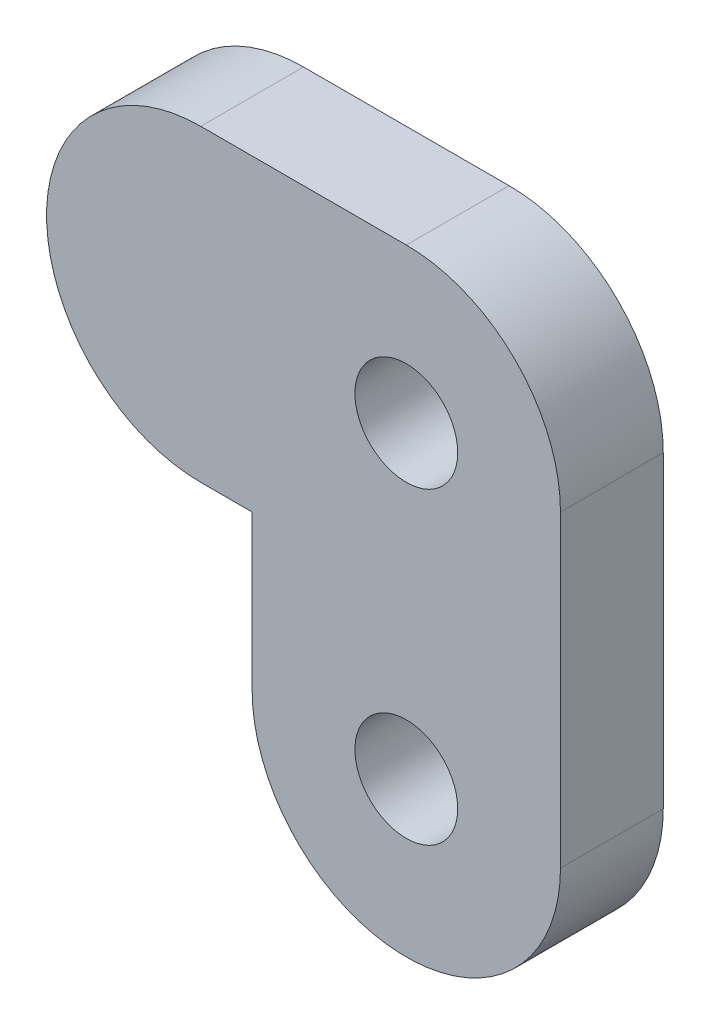
from build123d import *

# Parameters (mm, degrees)
MODEL_R                 = 1.5
SALIENTE_EXTRUIR1_DEPTH = 3


with BuildPart() as part:
    # Model → Saliente-Extruir1 (new body)
    with BuildSketch(Plane.XY):
        with BuildLine():
            Line((152.34213351, 211.823953209), (158.34213351, 211.823953209))
            ThreePointArc((158.34213351, 211.823953209), (161.524114025, 210.505933724), (162.84213351, 207.323953209))
            Line((162.84213351, 207.323953209), (162.84213351, 198.323953209))
            ThreePointArc((162.84213351, 198.323953209), (158.34213351, 193.823953209), (153.84213351, 198.323953209))
            Line((153.84213351, 198.323953209), (153.84213351, 202.823953209))
            Line((153.84213351, 202.823953209), (152.34213351, 202.823953209))
            ThreePointArc((152.34213351, 202.823953209), (147.84213351, 207.323953209), (152.34213351, 211.823953209))
        make_face()
        with Locations((158.34213351, 207.323953209)):
            Circle(MODEL_R, mode=Mode.SUBTRACT)
        with Locations((158.34213351, 198.323953209)):
            Circle(MODEL_R, mode=Mode.SUBTRACT)
    extrude(amount=SALIENTE_EXTRUIR1_DEPTH)


solid = part.part
